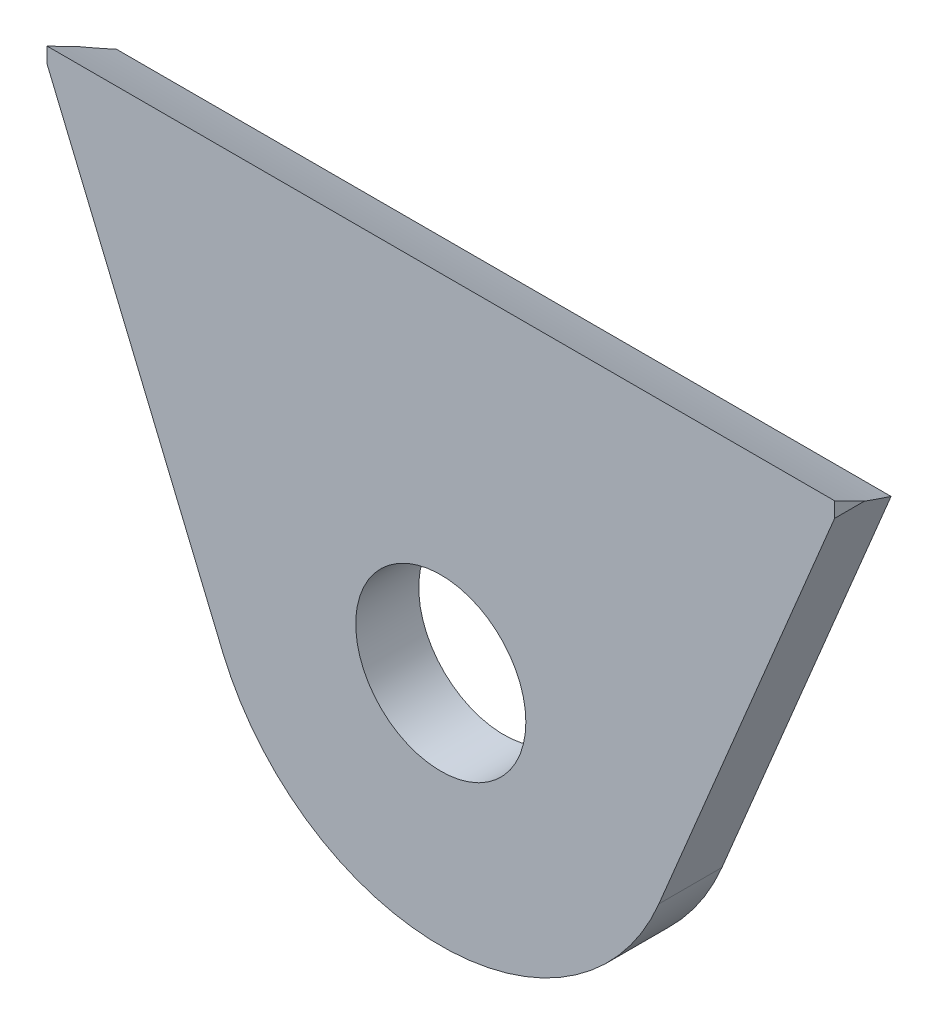
from build123d import *

# Parameters (mm, degrees)
SKETCH_1_R                 = 5.4
EXTRUDE_1_DEPTH            = 4
CUT_EXTRUDE_533_DEPTH      = 35.885527085
CUT_EXTRUDE_533_DEPTH_BACK = 35.885527085
SKETCH_513_R               = 72.5


with BuildPart() as part:
    # Эскиз1 → Бобышка-Вытянуть1 (new body)
    with BuildSketch(Plane.XY):
        with BuildLine():
            Line((-25, 24), (25, 24))
            Line((25, 24), (25, 21))
            Line((25, 21), (13.846153846, -5.769230769))
            ThreePointArc((13.846153846, -5.769230769), (0, -15), (-13.846153846, -5.769230769))
            Line((-13.846153846, -5.769230769), (-25, 21))
            Line((-25, 21), (-25, 24))
        make_face()
        Circle(SKETCH_1_R, mode=Mode.SUBTRACT)
    extrude(amount=EXTRUDE_1_DEPTH)

    # Sketch 513 → Cut-Extrude 533 (cut, two sides: drawn at the far end of the back side and taken through both)
    with BuildSketch(Plane(origin=(0, 0, 0), x_dir=(0, 0, -1), z_dir=(1, 0, 0)).offset(-CUT_EXTRUDE_533_DEPTH_BACK)):
        with Locations((30, 86)):
            Circle(SKETCH_513_R)
    extrude(amount=CUT_EXTRUDE_533_DEPTH + CUT_EXTRUDE_533_DEPTH_BACK, mode=Mode.SUBTRACT)


solid = part.part
